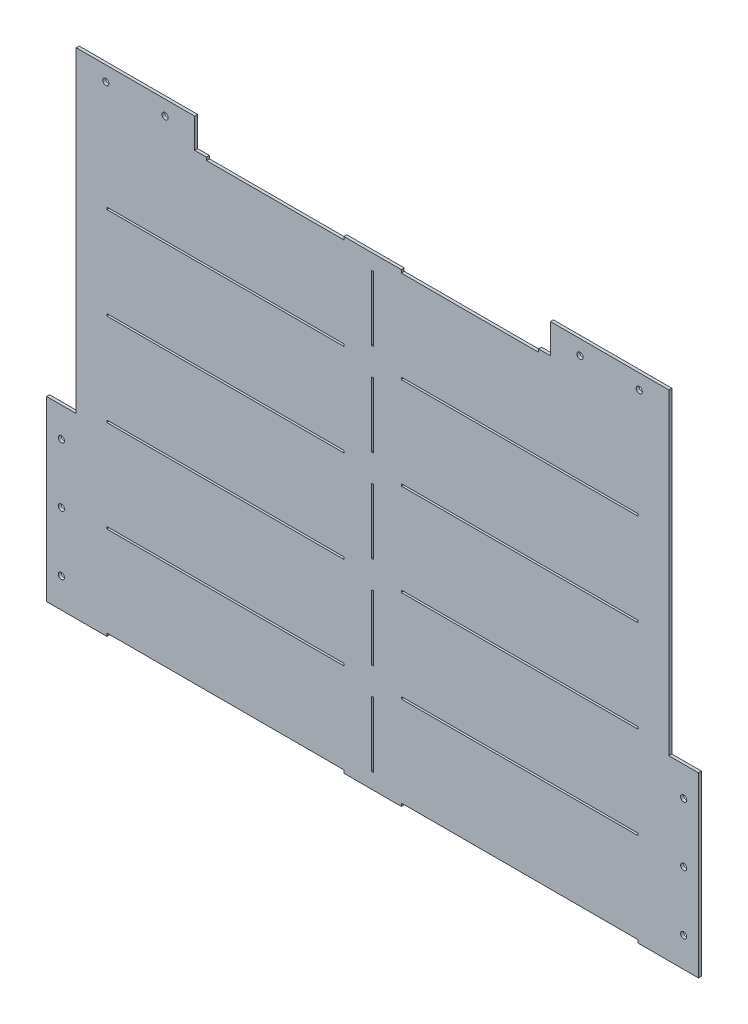
from build123d import *

# Parameters (mm, degrees)
MASTER_SKETCH_W         = 635.3556
MASTER_SKETCH_H         = 498.348
BOSS_EXTRUDE1_DEPTH     = 3.175
SKETCH2_W               = 31.75
SKETCH2_H               = 190.5
BOSS_EXTRUDE2_DEPTH     = 3.175
M6_CLEARANCE_HOLE1_D    = 6.6
SKETCH5_W               = 2.286
SKETCH5_H               = 69.85
CUT_EXTRUDE1_DEPTH      = 430.182420788
LPATTERN1_COUNT         = 5
LPATTERN1_PITCH         = 98.8568
SKETCH7_W               = 254
SKETCH7_H               = 2.286
CUT_EXTRUDE3_DEPTH      = 430.182420788
LPATTERN2_COUNT         = 4
LPATTERN2_PITCH         = 98.8568
MIRROR4_COPY_1_SKETCH_W = 254
MIRROR4_COPY_1_SKETCH_H = 2.286
MIRROR4_COPY_1_DEPTH    = 430.182420788
MIRROR4_COPY_2_SKETCH_W = 254
MIRROR4_COPY_2_SKETCH_H = 2.286
MIRROR4_COPY_2_DEPTH    = 430.182420788
MIRROR4_COPY_3_SKETCH_W = 254
MIRROR4_COPY_3_SKETCH_H = 2.286
MIRROR4_COPY_3_DEPTH    = 430.182420788
SKETCH10_W              = 127
SKETCH10_H              = 31.75
BOSS_EXTRUDE3_DEPTH     = 3.175
M6_CLEARANCE_HOLE2_D    = 6.6
SKETCH6_W               = 254
SKETCH6_H               = 3.175
SKETCH6_W_2             = 147.1549
CUT_EXTRUDE2_DEPTH      = 449.361641774


with BuildPart() as part:
    # Master Sketch → Boss-Extrude1 (new body)
    with BuildSketch(Plane.XY):
        Rectangle(MASTER_SKETCH_W, MASTER_SKETCH_H)
    extrude(amount=BOSS_EXTRUDE1_DEPTH)

    # Sketch2 → Boss-Extrude2 (add)
    with BuildSketch(Plane.XY.offset(3.175)):
        with Locations((-333.5528, -153.924)):
            Rectangle(SKETCH2_W, SKETCH2_H)
    boss_extrude2 = extrude(amount=-BOSS_EXTRUDE2_DEPTH)

    # M6 Clearance Hole1 (through all)
    with Locations(Plane.XY.offset(3.175)):
        with Locations((-333.5528, -90.424), (-333.5528, -153.924), (-333.5528, -217.424)):
            m6_clearance_hole1 = Hole(M6_CLEARANCE_HOLE1_D / 2)

    # Mirror1: Boss-Extrude2, M6 Clearance Hole1 across plane
    add(boss_extrude2.mirror(Plane(origin=(0, 0, 0), x_dir=(0, 0, 1), z_dir=(1, 0, 0))))
    add(m6_clearance_hole1.mirror(Plane(origin=(0, 0, 0), x_dir=(0, 0, 1), z_dir=(1, 0, 0))), mode=Mode.SUBTRACT)

    # Sketch5 → Cut-Extrude1 (cut, through all)
    with BuildSketch(Plane.XY.offset(3.175)):
        with Locations((0, 197.7136)):
            Rectangle(SKETCH5_W, SKETCH5_H)
    cut_extrude1 = extrude(amount=-CUT_EXTRUDE1_DEPTH, mode=Mode.SUBTRACT)

    # LPattern1: Cut-Extrude1 ×5
    with Locations(*[(0, -i * LPATTERN1_PITCH, 0) for i in range(1, LPATTERN1_COUNT)]):
        add(cut_extrude1, mode=Mode.SUBTRACT)

    # Sketch7 → Cut-Extrude3 (cut, through all)
    with BuildSketch(Plane.XY.offset(3.175)):
        with Locations((-157.8229, 148.2852)):
            Rectangle(SKETCH7_W, SKETCH7_H)
    cut_extrude3 = extrude(amount=-CUT_EXTRUDE3_DEPTH, mode=Mode.SUBTRACT)

    # LPattern2: Cut-Extrude3 ×4
    with Locations(*[(0, -i * LPATTERN2_PITCH, 0) for i in range(1, LPATTERN2_COUNT)]):
        add(cut_extrude3, mode=Mode.SUBTRACT)

    # Mirror4: Cut-Extrude3 across plane
    add(cut_extrude3.mirror(Plane(origin=(0, 0, 0), x_dir=(0, 0, 1), z_dir=(1, 0, 0))), mode=Mode.SUBTRACT)

    # Mirror4 copy 1 sketch → Mirror4 copy 1 (cut, through all)
    with BuildSketch(Plane(origin=(0, -98.8568, 3.175), x_dir=(-1, 0, 0), z_dir=(0, 0, 1))):
        with Locations((-157.8229, -148.2852)):
            Rectangle(MIRROR4_COPY_1_SKETCH_W, MIRROR4_COPY_1_SKETCH_H)
    extrude(amount=-MIRROR4_COPY_1_DEPTH, mode=Mode.SUBTRACT)

    # Mirror4 copy 2 sketch → Mirror4 copy 2 (cut, through all)
    with BuildSketch(Plane(origin=(0, -197.7136, 3.175), x_dir=(-1, 0, 0), z_dir=(0, 0, 1))):
        with Locations((-157.8229, -148.2852)):
            Rectangle(MIRROR4_COPY_2_SKETCH_W, MIRROR4_COPY_2_SKETCH_H)
    extrude(amount=-MIRROR4_COPY_2_DEPTH, mode=Mode.SUBTRACT)

    # Mirror4 copy 3 sketch → Mirror4 copy 3 (cut, through all)
    with BuildSketch(Plane(origin=(0, -296.5704, 3.175), x_dir=(-1, 0, 0), z_dir=(0, 0, 1))):
        with Locations((-157.8229, -148.2852)):
            Rectangle(MIRROR4_COPY_3_SKETCH_W, MIRROR4_COPY_3_SKETCH_H)
    extrude(amount=-MIRROR4_COPY_3_DEPTH, mode=Mode.SUBTRACT)

    # Sketch10 → Boss-Extrude3 (add)
    with BuildSketch(Plane.XY.offset(3.175)):
        with Locations((-254.1778, 265.049)):
            Rectangle(SKETCH10_W, SKETCH10_H)
    boss_extrude3 = extrude(amount=-BOSS_EXTRUDE3_DEPTH)

    # M6 Clearance Hole2 (through all)
    with Locations(Plane.XY.offset(3.175)):
        with Locations((-285.9278, 265.049), (-222.4278, 265.049)):
            m6_clearance_hole2 = Hole(M6_CLEARANCE_HOLE2_D / 2)

    # Mirror6: Boss-Extrude3, M6 Clearance Hole2 across plane
    add(boss_extrude3.mirror(Plane(origin=(0, 0, 0), x_dir=(0, 0, 1), z_dir=(1, 0, 0))))
    add(m6_clearance_hole2.mirror(Plane(origin=(0, 0, 0), x_dir=(0, 0, 1), z_dir=(1, 0, 0))), mode=Mode.SUBTRACT)

    # Sketch6 → Cut-Extrude2 (cut, through all)
    with BuildSketch(Plane.XY.offset(3.175)):
        with Locations((-157.8229, -247.5865)):
            Rectangle(SKETCH6_W, SKETCH6_H)
        with Locations((157.8229, -247.5865)):
            Rectangle(SKETCH6_W, SKETCH6_H)
        with Locations((-104.40035, 247.5865)):
            Rectangle(SKETCH6_W_2, SKETCH6_H)
        with Locations((104.40035, 247.5865)):
            Rectangle(SKETCH6_W_2, SKETCH6_H)
    extrude(amount=-CUT_EXTRUDE2_DEPTH, mode=Mode.SUBTRACT)


solid = part.part
